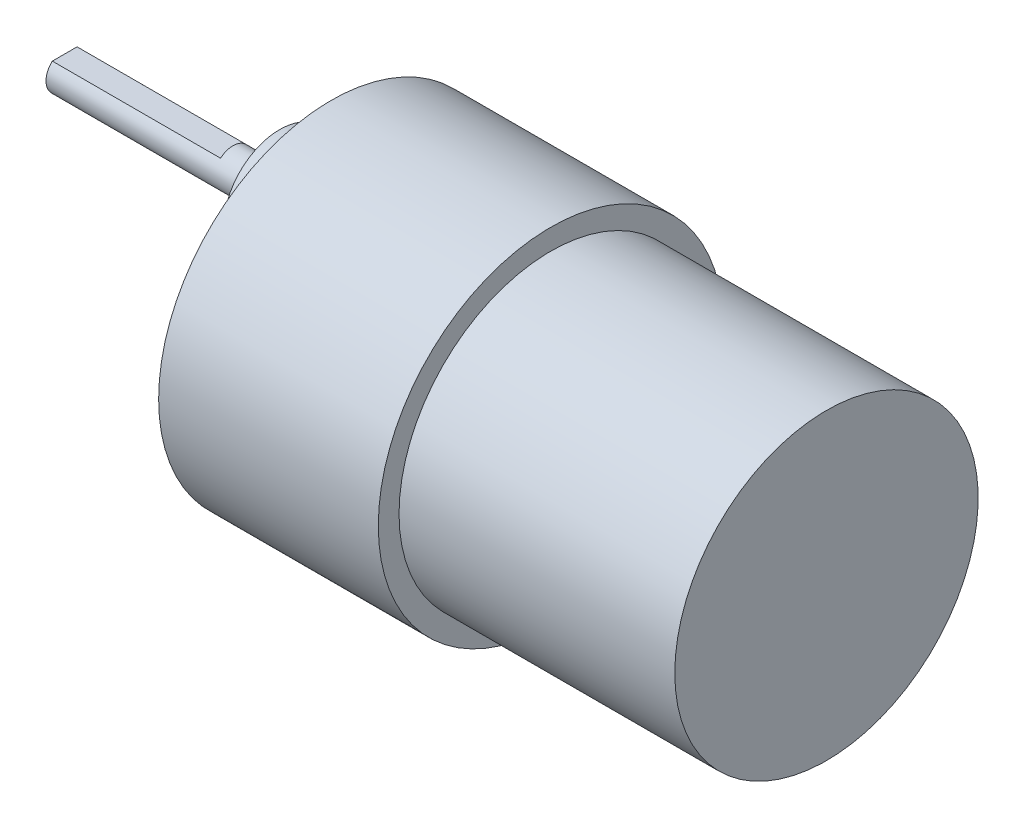
from build123d import *

# Parameters (mm, degrees)
SKETCH1_W                   = 23.5
SKETCH1_H                   = 18.45
SKETCH1_W_2                 = 29.5
SKETCH1_H_2                 = 16.23
M3_5X0_6_TAPPED_HOLE1_D     = 2.9
M3_5X0_6_TAPPED_HOLE1_DEPTH = 3.5
M3_5X0_6_TAPPED_HOLE1_TIP   = 0.871247898
SKETCH6_R                   = 6
BOSS_EXTRUDE1_DEPTH         = 5.5
SKETCH7_R                   = 2
BOSS_EXTRUDE2_DEPTH         = 23
CUT_EXTRUDE1_DEPTH          = 18


with BuildPart() as part:
    # Sketch1 → Revolve1 (revolve)
    with BuildSketch(Plane.XY, mode=Mode.PRIVATE) as revolve1_sk:
        with Locations((11.75, 9.225)):
            Rectangle(SKETCH1_W, SKETCH1_H)
        with Locations((38.25, 8.115)):
            Rectangle(SKETCH1_W_2, SKETCH1_H_2)
    revolve(revolve1_sk.sketch.rotate(Axis((0, 0, 0), (1, 0, 0)), 90), axis=Axis((0, 0, 0), (1, 0, 0)))

    # M3.5x0.6 Tapped Hole1
    with Locations(Plane.ZY):
        with Locations((7.75, 13.423393759), (15.5, 0), (7.75, -13.423393759), (-7.75, -13.423393759), (-15.5, 0), (-7.75, 13.423393759)):
            Hole(M3_5X0_6_TAPPED_HOLE1_D / 2, depth=M3_5X0_6_TAPPED_HOLE1_DEPTH)
            with Locations((0, 0, -(M3_5X0_6_TAPPED_HOLE1_DEPTH + M3_5X0_6_TAPPED_HOLE1_TIP / 2))):  # 118° drill point
                Cone(0, M3_5X0_6_TAPPED_HOLE1_D / 2, M3_5X0_6_TAPPED_HOLE1_TIP, mode=Mode.SUBTRACT)

    # Sketch6 → Boss-Extrude1 (add)
    with BuildSketch(Plane.ZY):
        with Locations((0, 7)):
            Circle(SKETCH6_R)
    extrude(amount=BOSS_EXTRUDE1_DEPTH)

    # Sketch7 → Boss-Extrude2 (add)
    with BuildSketch(Plane.ZY.offset(5.5)):
        with Locations((0, 7)):
            Circle(SKETCH7_R)
    extrude(amount=BOSS_EXTRUDE2_DEPTH)

    # Sketch8 → Cut-Extrude1 (cut)
    with BuildSketch(Plane.ZY.offset(28.5)):
        Polygon((-78.17402708, 8.5), (-1.322875656, 8.5), (1.322875656, 8.5), (78.17402708, 8.5), (78.17402708, 162.202302849), (-78.17402708, 162.202302849), align=None)
    extrude(amount=-CUT_EXTRUDE1_DEPTH, mode=Mode.SUBTRACT)


solid = part.part
